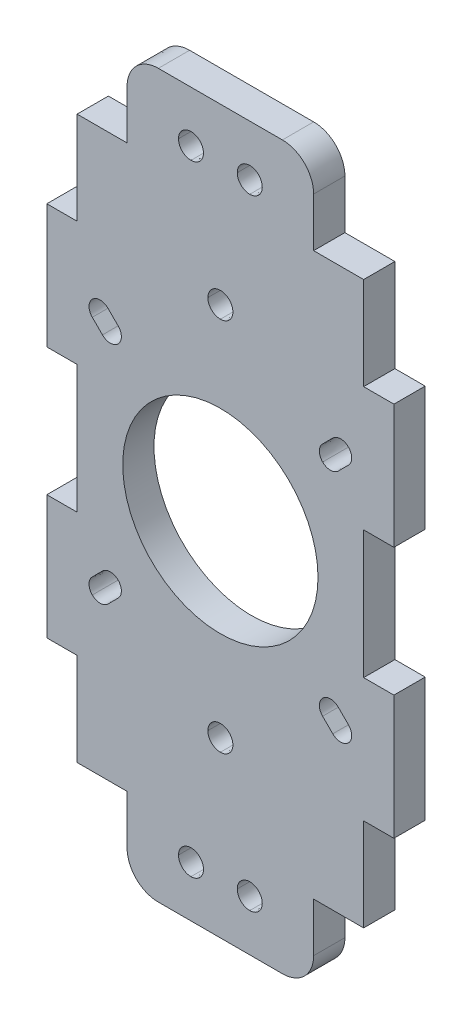
from build123d import *

# Parameters (mm, degrees)
MODEL_R             = 19.83955
BOSS_EXTRUDE1_DEPTH = 6.35


with BuildPart() as part:
    # Model → Boss-Extrude1 (new body)
    with BuildSketch(Plane.XY):
        with BuildLine():
            Line((-20.5954, 56.0124), (-20.5954, 81.2129))
            Line((-20.5954, 81.2129), (-14.4452, 81.2129))
            Line((-14.4452, 81.2129), (-14.4452, 107.2136))
            Line((-14.4452, 107.2136), (-20.5954, 107.2136))
            Line((-20.5954, 107.2136), (-20.5954, 132.4124))
            Line((-20.5954, 132.4124), (-14.4452, 132.4124))
            Line((-14.4452, 132.4124), (-14.4452, 151.262))
            Line((-14.4452, 151.262), (-4.2849, 151.262))
            Line((-4.2849, 151.262), (-4.2849, 161.223))
            add(Edge.make_bspline(
                [(2.0647, 167.573), (-1.4529, 167.573), (-4.2849, 164.741), (-4.2849, 161.223)],
                knots=[0.181818182, 0.181818182, 0.181818182, 0.181818182, 0.212121212, 0.212121212, 0.212121212, 0.212121212], degree=3))
            Line((2.0647, 167.573), (27.2651, 167.573))
            add(Edge.make_bspline(
                [(33.6151, 161.223), (33.6151, 164.741), (30.7835, 167.573), (27.2651, 167.573)],
                knots=[0.121212121, 0.121212121, 0.121212121, 0.121212121, 0.151515152, 0.151515152, 0.151515152, 0.151515152], degree=3))
            Line((33.6151, 161.223), (33.6151, 151.262))
            Line((33.6151, 151.262), (43.7754, 151.262))
            Line((43.7754, 151.262), (43.7754, 132.4124))
            Line((43.7754, 132.4124), (49.9256, 132.4124))
            Line((49.9256, 132.4124), (49.9256, 107.2136))
            Line((49.9256, 107.2136), (43.7754, 107.2136))
            Line((43.7754, 107.2136), (43.7754, 81.2129))
            Line((43.7754, 81.2129), (49.9256, 81.2129))
            Line((49.9256, 81.2129), (49.9256, 56.0124))
            Line((49.9256, 56.0124), (43.7754, 56.0124))
            Line((43.7754, 56.0124), (43.7754, 37.1628))
            Line((43.7754, 37.1628), (33.6151, 37.1628))
            Line((33.6151, 37.1628), (33.6151, 27.2034))
            add(Edge.make_bspline(
                [(27.2651, 20.8535), (30.7835, 20.8535), (33.6151, 23.6854), (33.6151, 27.2034)],
                knots=[0.666666667, 0.666666667, 0.666666667, 0.666666667, 0.696969697, 0.696969697, 0.696969697, 0.696969697], degree=3))
            Line((27.2651, 20.8535), (2.0647, 20.8535))
            add(Edge.make_bspline(
                [(-4.2849, 27.2034), (-4.2849, 23.6854), (-1.4529, 20.8535), (2.0647, 20.8535)],
                knots=[0.606060606, 0.606060606, 0.606060606, 0.606060606, 0.636363636, 0.636363636, 0.636363636, 0.636363636], degree=3))
            Line((-4.2849, 27.2034), (-4.2849, 37.1628))
            Line((-4.2849, 37.1628), (-14.4452, 37.1628))
            Line((-14.4452, 37.1628), (-14.4452, 56.0124))
            Line((-14.4452, 56.0124), (-20.5954, 56.0124))
        make_face()
        with Locations((14.6645, 94.21325)):
            Circle(MODEL_R, mode=Mode.SUBTRACT)
        with BuildLine():
            Line((-6.1122, 70.2543), (-8.1775, 68.1903))
            add(Edge.make_bspline(
                [(-8.1775, 68.1903), (-9.0583, 67.3086), (-10.4778, 67.3086), (-11.3583, 68.1903)],
                knots=[0.142857143, 0.142857143, 0.142857143, 0.142857143, 0.285714286, 0.285714286, 0.285714286, 0.285714286], degree=3))
            add(Edge.make_bspline(
                [(-11.3583, 68.1903), (-12.2399, 69.0707), (-12.2399, 70.4906), (-11.3583, 71.3711)],
                knots=[0.285714286, 0.285714286, 0.285714286, 0.285714286, 0.428571429, 0.428571429, 0.428571429, 0.428571429], degree=3))
            Line((-11.3583, 71.3711), (-9.293, 73.4364))
            add(Edge.make_bspline(
                [(-9.293, 73.4364), (-8.4121, 74.3185), (-6.9926, 74.3185), (-6.1122, 73.4364)],
                knots=[0.571428571, 0.571428571, 0.571428571, 0.571428571, 0.714285714, 0.714285714, 0.714285714, 0.714285714], degree=3))
            add(Edge.make_bspline(
                [(-6.1122, 73.4364), (-5.2301, 72.5559), (-5.2301, 71.1364), (-6.1122, 70.2543)],
                knots=[0.714285714, 0.714285714, 0.714285714, 0.714285714, 1, 1, 1, 1], degree=3))
        make_face(mode=Mode.SUBTRACT)
        with BuildLine():
            Line((40.6885, 117.0554), (38.6232, 114.9897))
            add(Edge.make_bspline(
                [(38.6232, 114.9897), (37.7415, 114.1092), (36.3232, 114.1092), (35.4411, 114.9897)],
                knots=[0.142857143, 0.142857143, 0.142857143, 0.142857143, 0.285714286, 0.285714286, 0.285714286, 0.285714286], degree=3))
            add(Edge.make_bspline(
                [(35.4411, 114.9897), (34.5607, 115.8705), (34.5607, 117.29), (35.4411, 118.1717)],
                knots=[0.285714286, 0.285714286, 0.285714286, 0.285714286, 0.428571429, 0.428571429, 0.428571429, 0.428571429], degree=3))
            Line((35.4411, 118.1717), (37.5068, 120.2357))
            add(Edge.make_bspline(
                [(37.5068, 120.2357), (38.3885, 121.1178), (39.8068, 121.1178), (40.6889, 120.2357)],
                knots=[0.571428571, 0.571428571, 0.571428571, 0.571428571, 0.714285714, 0.714285714, 0.714285714, 0.714285714], degree=3))
            add(Edge.make_bspline(
                [(40.6889, 120.2357), (41.5693, 119.3553), (41.5693, 117.9358), (40.6885, 117.0554)],
                knots=[0.714285714, 0.714285714, 0.714285714, 0.714285714, 1, 1, 1, 1], degree=3))
        make_face(mode=Mode.SUBTRACT)
        with BuildLine():
            Line((40.6885, 71.3707), (38.6227, 73.4364))
            add(Edge.make_bspline(
                [(38.6227, 73.4364), (37.7411, 74.3185), (36.3228, 74.3185), (35.4407, 73.4364)],
                knots=[0.142857143, 0.142857143, 0.142857143, 0.142857143, 0.285714286, 0.285714286, 0.285714286, 0.285714286], degree=3))
            add(Edge.make_bspline(
                [(35.4407, 73.4364), (34.5603, 72.5559), (34.5607, 71.1368), (35.4411, 70.2547)],
                knots=[0.285714286, 0.285714286, 0.285714286, 0.285714286, 0.428571429, 0.428571429, 0.428571429, 0.428571429], degree=3))
            Line((35.4411, 70.2547), (37.5068, 68.1903))
            add(Edge.make_bspline(
                [(37.5068, 68.1903), (38.3889, 67.3086), (39.8064, 67.3086), (40.6885, 68.1903)],
                knots=[0.571428571, 0.571428571, 0.571428571, 0.571428571, 0.714285714, 0.714285714, 0.714285714, 0.714285714], degree=3))
            add(Edge.make_bspline(
                [(40.6885, 68.1903), (41.5689, 69.0707), (41.5693, 70.4902), (40.6885, 71.3707)],
                knots=[0.714285714, 0.714285714, 0.714285714, 0.714285714, 1, 1, 1, 1], degree=3))
        make_face(mode=Mode.SUBTRACT)
        with BuildLine():
            Line((-6.1122, 118.1717), (-8.1766, 120.2357))
            add(Edge.make_bspline(
                [(-8.1766, 120.2357), (-9.0587, 121.1178), (-10.4782, 121.1178), (-11.3587, 120.2357)],
                knots=[0.142857143, 0.142857143, 0.142857143, 0.142857143, 0.285714286, 0.285714286, 0.285714286, 0.285714286], degree=3))
            add(Edge.make_bspline(
                [(-11.3587, 120.2357), (-12.2391, 119.3553), (-12.2387, 117.9362), (-11.3583, 117.0554)],
                knots=[0.285714286, 0.285714286, 0.285714286, 0.285714286, 0.428571429, 0.428571429, 0.428571429, 0.428571429], degree=3))
            Line((-11.3583, 117.0554), (-9.2926, 114.9897))
            add(Edge.make_bspline(
                [(-9.2926, 114.9897), (-8.4121, 114.1076), (-6.993, 114.1076), (-6.1126, 114.9897)],
                knots=[0.571428571, 0.571428571, 0.571428571, 0.571428571, 0.714285714, 0.714285714, 0.714285714, 0.714285714], degree=3))
            add(Edge.make_bspline(
                [(-6.1126, 114.9897), (-5.2305, 115.8705), (-5.2301, 117.2896), (-6.1122, 118.1717)],
                knots=[0.714285714, 0.714285714, 0.714285714, 0.714285714, 1, 1, 1, 1], degree=3))
        make_face(mode=Mode.SUBTRACT)
        with BuildLine():
            add(Edge.make_bspline(
                [(8.6945, 154.6937), (10.0978, 154.6937), (11.2349, 155.8307), (11.2349, 157.2336)],
                knots=[0, 0, 0, 0, 0.2, 0.2, 0.2, 0.2], degree=3))
            add(Edge.make_bspline(
                [(11.2349, 157.2336), (11.2349, 158.6365), (10.0978, 159.7728), (8.6945, 159.7728)],
                knots=[0.2, 0.2, 0.2, 0.2, 0.4, 0.4, 0.4, 0.4], degree=3))
            add(Edge.make_bspline(
                [(8.6945, 159.7728), (7.2921, 159.7728), (6.1537, 158.6365), (6.1537, 157.2336)],
                knots=[0.4, 0.4, 0.4, 0.4, 0.6, 0.6, 0.6, 0.6], degree=3))
            add(Edge.make_bspline(
                [(6.1537, 157.2336), (6.1537, 155.8307), (7.2921, 154.6937), (8.6945, 154.6937)],
                knots=[0.6, 0.6, 0.6, 0.6, 1, 1, 1, 1], degree=3))
        make_face(mode=Mode.SUBTRACT)
        with BuildLine():
            add(Edge.make_bspline(
                [(8.6945, 28.6532), (10.0978, 28.6532), (11.2349, 29.7899), (11.2349, 31.1928)],
                knots=[0, 0, 0, 0, 0.2, 0.2, 0.2, 0.2], degree=3))
            add(Edge.make_bspline(
                [(11.2349, 31.1928), (11.2349, 32.5953), (10.0978, 33.7324), (8.6945, 33.7324)],
                knots=[0.2, 0.2, 0.2, 0.2, 0.4, 0.4, 0.4, 0.4], degree=3))
            add(Edge.make_bspline(
                [(8.6945, 33.7324), (7.2921, 33.7324), (6.1537, 32.5953), (6.1537, 31.1928)],
                knots=[0.4, 0.4, 0.4, 0.4, 0.6, 0.6, 0.6, 0.6], degree=3))
            add(Edge.make_bspline(
                [(6.1537, 31.1928), (6.1537, 29.7899), (7.2921, 28.6532), (8.6945, 28.6532)],
                knots=[0.6, 0.6, 0.6, 0.6, 1, 1, 1, 1], degree=3))
        make_face(mode=Mode.SUBTRACT)
        with BuildLine():
            add(Edge.make_bspline(
                [(20.6352, 154.6937), (22.0385, 154.6937), (23.1752, 155.8307), (23.1752, 157.2336)],
                knots=[0, 0, 0, 0, 0.2, 0.2, 0.2, 0.2], degree=3))
            add(Edge.make_bspline(
                [(23.1752, 157.2336), (23.1752, 158.6365), (22.0385, 159.7728), (20.6352, 159.7728)],
                knots=[0.2, 0.2, 0.2, 0.2, 0.4, 0.4, 0.4, 0.4], degree=3))
            add(Edge.make_bspline(
                [(20.6352, 159.7728), (19.2328, 159.7728), (18.0957, 158.6365), (18.0957, 157.2336)],
                knots=[0.4, 0.4, 0.4, 0.4, 0.6, 0.6, 0.6, 0.6], degree=3))
            add(Edge.make_bspline(
                [(18.0957, 157.2336), (18.0957, 155.8307), (19.2328, 154.6937), (20.6352, 154.6937)],
                knots=[0.6, 0.6, 0.6, 0.6, 1, 1, 1, 1], degree=3))
        make_face(mode=Mode.SUBTRACT)
        with BuildLine():
            add(Edge.make_bspline(
                [(20.6352, 28.6532), (22.0385, 28.6532), (23.1752, 29.7899), (23.1752, 31.1928)],
                knots=[0, 0, 0, 0, 0.2, 0.2, 0.2, 0.2], degree=3))
            add(Edge.make_bspline(
                [(23.1752, 31.1928), (23.1752, 32.5953), (22.0385, 33.7324), (20.6352, 33.7324)],
                knots=[0.2, 0.2, 0.2, 0.2, 0.4, 0.4, 0.4, 0.4], degree=3))
            add(Edge.make_bspline(
                [(20.6352, 33.7324), (19.2328, 33.7324), (18.0957, 32.5953), (18.0957, 31.1928)],
                knots=[0.4, 0.4, 0.4, 0.4, 0.6, 0.6, 0.6, 0.6], degree=3))
            add(Edge.make_bspline(
                [(18.0957, 31.1928), (18.0957, 29.7899), (19.2328, 28.6532), (20.6352, 28.6532)],
                knots=[0.6, 0.6, 0.6, 0.6, 1, 1, 1, 1], degree=3))
        make_face(mode=Mode.SUBTRACT)
        with BuildLine():
            add(Edge.make_bspline(
                [(14.6645, 129.7262), (16.0674, 129.7262), (17.2053, 130.8633), (17.2053, 132.2662)],
                knots=[0, 0, 0, 0, 0.2, 0.2, 0.2, 0.2], degree=3))
            add(Edge.make_bspline(
                [(17.2053, 132.2662), (17.2053, 133.6691), (16.0674, 134.8074), (14.6645, 134.8074)],
                knots=[0.2, 0.2, 0.2, 0.2, 0.4, 0.4, 0.4, 0.4], degree=3))
            add(Edge.make_bspline(
                [(14.6645, 134.8074), (13.2616, 134.8074), (12.1245, 133.6691), (12.1245, 132.2662)],
                knots=[0.4, 0.4, 0.4, 0.4, 0.6, 0.6, 0.6, 0.6], degree=3))
            add(Edge.make_bspline(
                [(12.1245, 132.2662), (12.1245, 130.8633), (13.2616, 129.7262), (14.6645, 129.7262)],
                knots=[0.6, 0.6, 0.6, 0.6, 1, 1, 1, 1], degree=3))
        make_face(mode=Mode.SUBTRACT)
        with BuildLine():
            add(Edge.make_bspline(
                [(14.6645, 53.5264), (16.0674, 53.5264), (17.2053, 54.6635), (17.2053, 56.0664)],
                knots=[0, 0, 0, 0, 0.2, 0.2, 0.2, 0.2], degree=3))
            add(Edge.make_bspline(
                [(17.2053, 56.0664), (17.2053, 57.4693), (16.0674, 58.6076), (14.6645, 58.6076)],
                knots=[0.2, 0.2, 0.2, 0.2, 0.4, 0.4, 0.4, 0.4], degree=3))
            add(Edge.make_bspline(
                [(14.6645, 58.6076), (13.2616, 58.6076), (12.1245, 57.4693), (12.1245, 56.0664)],
                knots=[0.4, 0.4, 0.4, 0.4, 0.6, 0.6, 0.6, 0.6], degree=3))
            add(Edge.make_bspline(
                [(12.1245, 56.0664), (12.1245, 54.6635), (13.2616, 53.5264), (14.6645, 53.5264)],
                knots=[0.6, 0.6, 0.6, 0.6, 1, 1, 1, 1], degree=3))
        make_face(mode=Mode.SUBTRACT)
    extrude(amount=BOSS_EXTRUDE1_DEPTH)


solid = part.part
